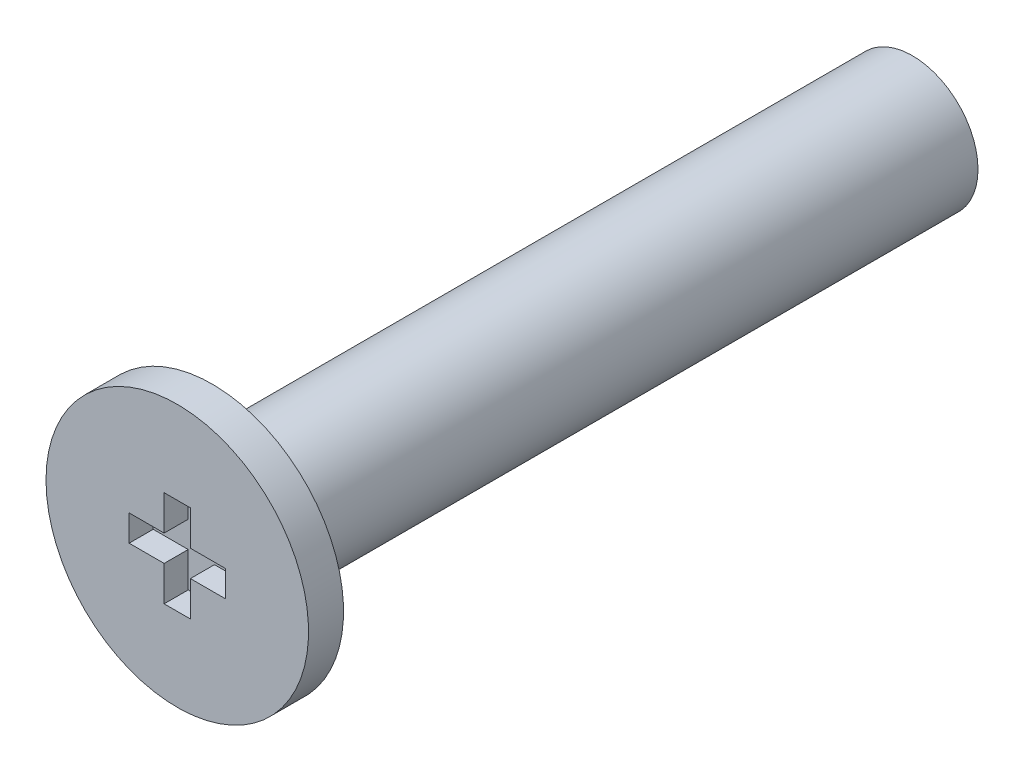
from build123d import *

# Parameters (mm, degrees)
SKETCH_1_R        = 1.5
EXTRUDE_198_DEPTH = 16
SKETCH_6_W        = 3
SKETCH_6_H        = 0.8
PH1_START         = 0.81
PH1_DEPTH         = 0.56


with BuildPart() as part:
    # 草图1 → Extrude 198 (new body)
    with BuildSketch(Plane.XY):
        Circle(SKETCH_1_R)
    extrude(amount=-EXTRUDE_198_DEPTH)

    # 草图6 → Revolve 324 (revolve)
    with BuildSketch(Plane(origin=(0, 0, 0), x_dir=(1, 0, 0), z_dir=(0, 1, 0)), mode=Mode.PRIVATE) as revolve_324_sk:
        with Locations((1.5, -0.4)):
            Rectangle(SKETCH_6_W, SKETCH_6_H)
    revolve(revolve_324_sk.sketch.rotate(Axis((0, 0, -2), (0, 0, 1)), 180), axis=Axis((0, 0, -2), (0, 0, 1)))

    # 草图7 → 十字槽_PH1_简化 (cut)
    with BuildSketch(Plane.XY.offset(PH1_START)):
        Polygon((-0.3, -1.1), (0.3, -1.1), (0.3, -0.3), (1.1, -0.3), (1.1, 0.3), (0.3, 0.3), (0.3, 1.1), (-0.3, 1.1), (-0.3, 0.3), (-1.1, 0.3), (-1.1, -0.3), (-0.3, -0.3), align=None)
    extrude(amount=-PH1_DEPTH, mode=Mode.SUBTRACT)


solid = part.part
